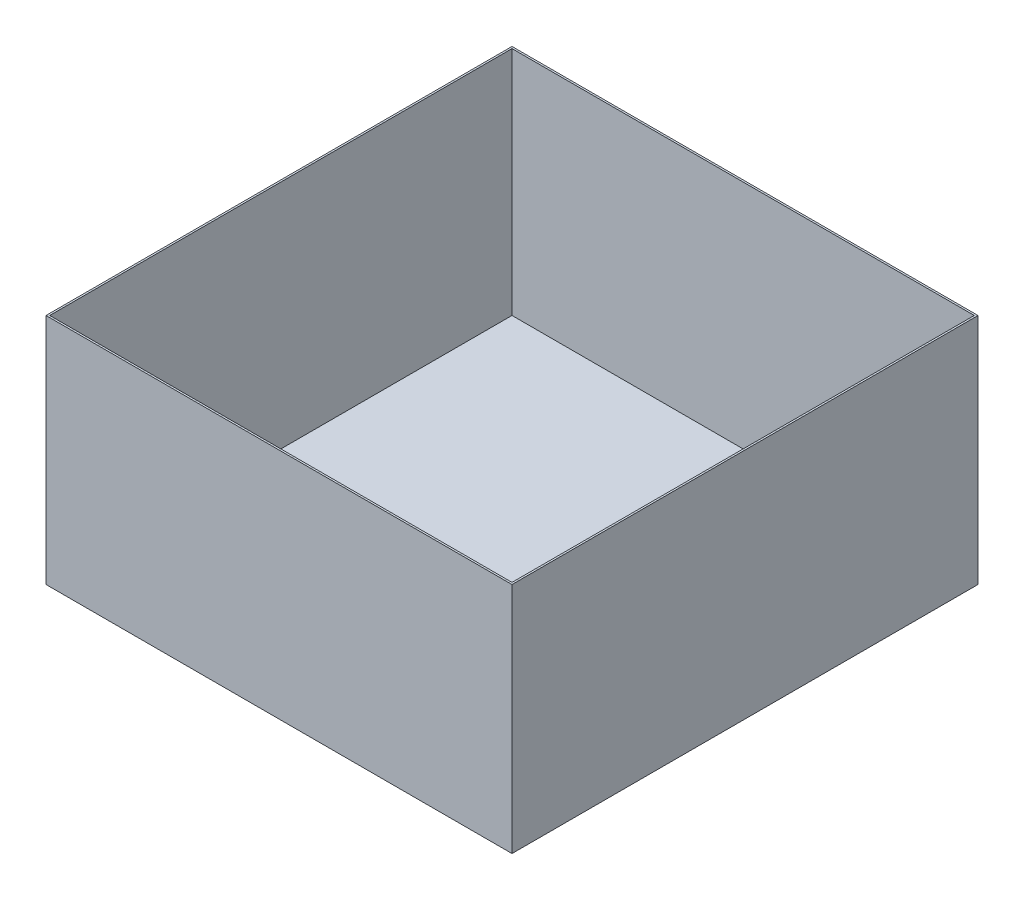
from build123d import *

# Parameters (mm, degrees)
SKETCH1_W           = 500
SKETCH1_H           = 500
BOSS_EXTRUDE1_DEPTH = 250
SHELL1_T            = -2


with BuildPart() as part:
    # Sketch1 → Boss-Extrude1 (new body)
    with BuildSketch(Plane(origin=(0, 0, 0), x_dir=(1, 0, 0), z_dir=(0, 1, 0))):
        with Locations((250, 250)):
            Rectangle(SKETCH1_W, SKETCH1_H)
    extrude(amount=-BOSS_EXTRUDE1_DEPTH)

    # Shell1
    shell1_openings = [part.faces().sort_by_distance(p)[0] for p in [
        (250, 0, -250),
    ]]
    offset(amount=SHELL1_T, openings=shell1_openings, kind=Kind.INTERSECTION)


solid = part.part
